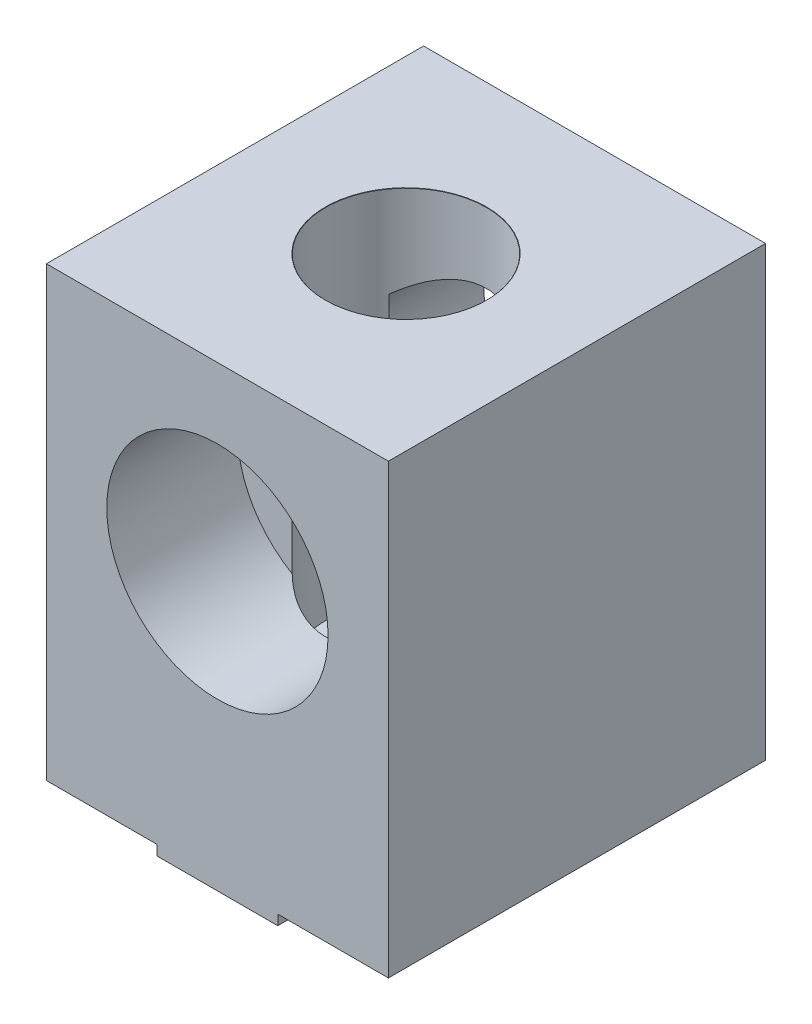
from build123d import *

# Parameters (mm, degrees)
SKETCH_1_W             = 34
SKETCH_1_H             = 37.5
EXTRUDE_282_DEPTH      = 44.5
SKETCH_2_W             = 12
SKETCH_2_H             = 37.5
EXTRUDE_458_DEPTH      = 1
SKETCH_3_R             = 6.5
CUT_EXTRUDE_1_DEPTH    = 61.625902055
SKETCH_4_R             = 11
CUT_EXTRUDE_843_DEPTH  = 13
CUT_EXTRUDE_START      = -14
SKETCH_5_R             = 11
CUT_EXTRUDE_1029_DEPTH = 14


with BuildPart() as part:
    # Эскиз1 → Extrude 282 (new body)
    with BuildSketch(Plane(origin=(0, 0, 0), x_dir=(1, 0, 0), z_dir=(0, 1, 0))):
        Rectangle(SKETCH_1_W, SKETCH_1_H)
    extrude(amount=EXTRUDE_282_DEPTH)

    # Эскиз2 → Extrude 458 (add)
    with BuildSketch(Plane.XZ):
        Rectangle(SKETCH_2_W, SKETCH_2_H)
    extrude(amount=EXTRUDE_458_DEPTH)

    # Эскиз3 → Вырез-Вытянуть1 (cut, through all)
    with BuildSketch(Plane.XY.offset(18.75)):
        with Locations((0, 26.5)):
            Circle(SKETCH_3_R)
    extrude(amount=-CUT_EXTRUDE_1_DEPTH, mode=Mode.SUBTRACT)

    # Эскиз4 → Cut-Extrude 843 (cut)
    with BuildSketch(Plane.XY.offset(18.75)):
        with Locations((0, 26.5)):
            Circle(SKETCH_4_R)
    extrude(amount=-CUT_EXTRUDE_843_DEPTH, mode=Mode.SUBTRACT)

    # Эскиз5 → Cut-Extrude 1029 (cut)
    with BuildSketch(Plane(origin=(0, 0, -18.75), x_dir=(-1, 0, 0), z_dir=(0, 0, -1)).offset(CUT_EXTRUDE_START)):
        with Locations(Location((0, 26.5, 0), (0, 0, 180))):
            Circle(SKETCH_5_R)
    extrude(amount=CUT_EXTRUDE_1029_DEPTH, mode=Mode.SUBTRACT)

    # Эскиз7 → К профилю M6 (revolve, cut)
    with BuildSketch(Plane(origin=(0, 44.5, 0), x_dir=(0, 0, 1), z_dir=(1, 0, 0))):
        Polygon((0, 0), (0, 45.5), (3.3, 45.5), (3.3, 35.6), (8, 35.6), (8, 0.025), (8.025, 0), align=None)
    revolve(axis=Axis((0, 50.85, 0), (0, -1, 0)), mode=Mode.SUBTRACT)


solid = part.part
